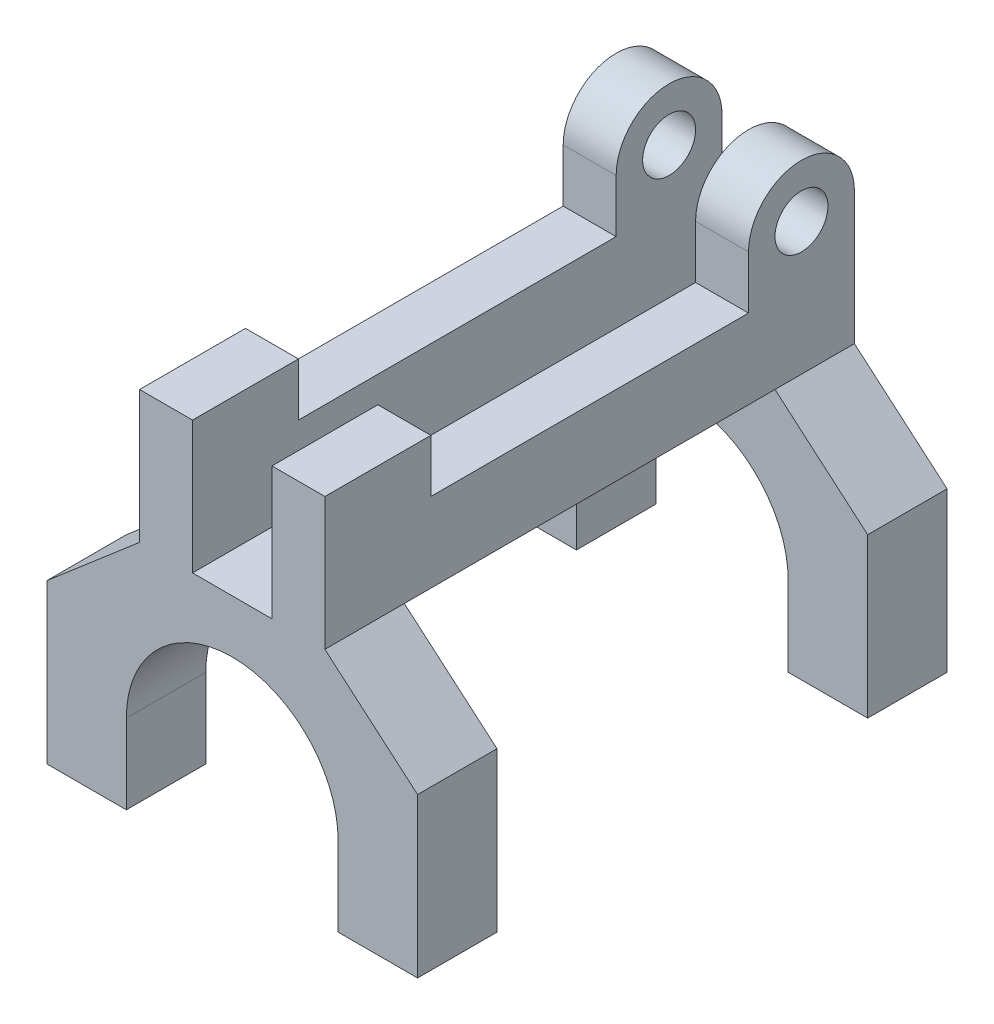
from build123d import *

# Parameters (mm, degrees)
EXTRUDE1_DEPTH = 127
SKETCH4_R      = 6.35
EXTRUDE2_DEPTH = 44.45
SKETCH5_W      = 19.05
SKETCH5_H      = 76.2
EXTRUDE3_DEPTH = 137.668
SKETCH8_W      = 88.9
SKETCH8_H      = 57.15
EXTRUDE4_DEPTH = 137.668


with BuildPart() as part:
    # Sketch2 → Extrude1 (new body)
    with BuildSketch(Plane.XY):
        with BuildLine():
            Line((25.4, 0), (25.4, -19.05))
            Line((25.4, -19.05), (44.45, -19.05))
            Line((44.45, -19.05), (44.45, 19.05))
            Line((44.45, 19.05), (22.225, 38.1))
            Line((22.225, 38.1), (-22.225, 38.1))
            Line((-22.225, 38.1), (-44.45, 19.05))
            Line((-44.45, 19.05), (-44.45, -19.05))
            Line((-44.45, -19.05), (-25.4, -19.05))
            Line((-25.4, -19.05), (-25.4, 0))
            ThreePointArc((-25.4, 0), (0, 25.4), (25.4, 0))
        make_face()
    extrude(amount=EXTRUDE1_DEPTH)

    # Sketch4 → Extrude2 (add)
    with BuildSketch(Plane(origin=(22.225, 0, 0), x_dir=(0, 0, -1), z_dir=(1, 0, 0))):
        with BuildLine():
            Line((0, 38.1), (-127, 38.1))
            Line((-127, 38.1), (-127, 69.85))
            Line((-127, 69.85), (-101.6, 69.85))
            Line((-101.6, 69.85), (-101.6, 57.15))
            Line((-101.6, 57.15), (-25.4, 57.15))
            Line((-25.4, 57.15), (-25.4, 69.85))
            ThreePointArc((-25.4, 69.85), (-12.7, 82.55), (0, 69.85))
            Line((0, 69.85), (0, 38.1))
        make_face()
        with Locations(Location((-12.7, 69.85, 0), (0, 0, 90))):
            Circle(SKETCH4_R, mode=Mode.SUBTRACT)
    extrude(amount=-EXTRUDE2_DEPTH)

    # Sketch5 → Extrude3 (cut)
    with BuildSketch(Plane.XY.offset(127)):
        with Locations((0, 76.2)):
            Rectangle(SKETCH5_W, SKETCH5_H)
    extrude(amount=-EXTRUDE3_DEPTH, mode=Mode.SUBTRACT)

    # Sketch8 → Extrude4 (cut)
    with BuildSketch(Plane.ZY.offset(44.45)):
        with Locations((63.5, 9.525)):
            Rectangle(SKETCH8_W, SKETCH8_H)
    extrude(amount=-EXTRUDE4_DEPTH, mode=Mode.SUBTRACT)


solid = part.part
